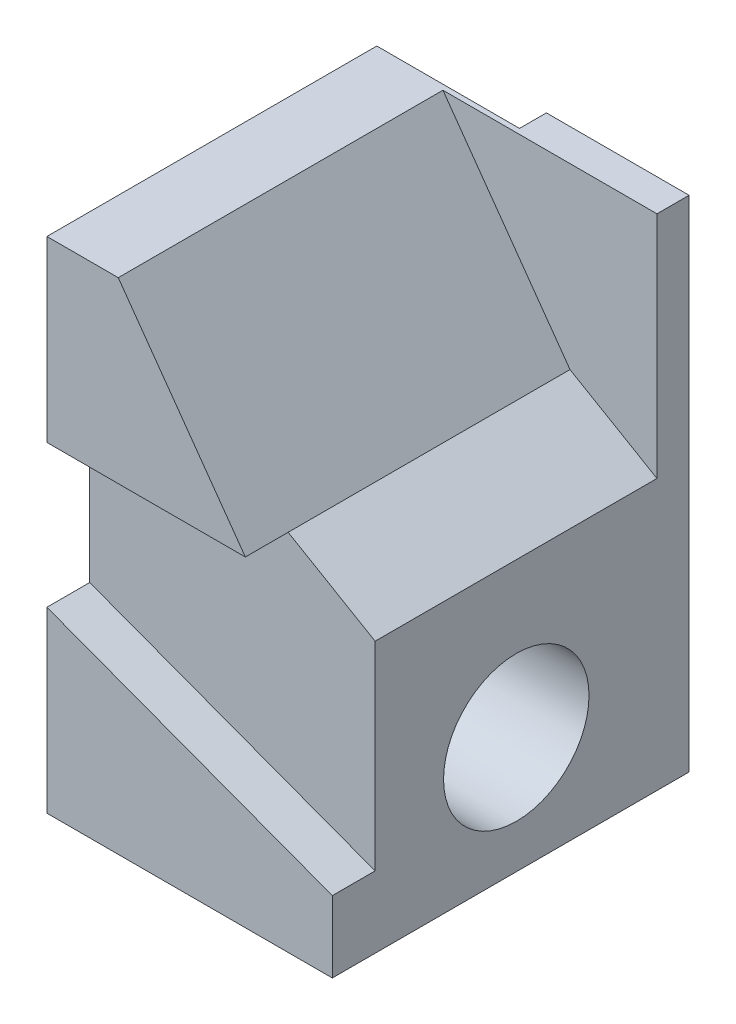
from build123d import *

# Parameters (mm, degrees)
CROQUIS1_W              = 80
CROQUIS1_H              = 88
SALIENTE_EXTRUIR2_DEPTH = 50
SALIENTE_EXTRUIR3_DEPTH = 12
SALIENTE_EXTRUIR4_DEPTH = 90
SALIENTE_EXTRUIR5_DEPTH = 12
CORTAR_EXTRUIR1_DEPTH   = 79
CORTAR_EXTRUIR3_DEPTH   = 34
CROQUIS13_R             = 20.383603437
CORTAR_EXTRUIR5_DEPTH   = 80
SALIENTE_EXTRUIR8_DEPTH = 34
CORTAR_EXTRUIR7_DEPTH   = 79


with BuildPart() as part:
    # Croquis1 → Saliente-Extruir2 (new body)
    with BuildSketch(Plane(origin=(0, 0, 0), x_dir=(1, 0, 0), z_dir=(0, 1, 0))):
        Rectangle(CROQUIS1_W, CROQUIS1_H)
    extrude(amount=SALIENTE_EXTRUIR2_DEPTH)

    # Croquis3 → Saliente-Extruir3 (add)
    with BuildSketch(Plane.XY.offset(44)):
        Polygon((40, 0), (40, 20), (-40, 50), (-40, 0), align=None)
    extrude(amount=SALIENTE_EXTRUIR3_DEPTH)

    # Croquis4 → Saliente-Extruir4 (add)
    with BuildSketch(Plane(origin=(0, 50, 0), x_dir=(1, 0, 0), z_dir=(0, 1, 0))):
        Polygon((-40, -44), (-40, 36.464593772), (-20, 36.464593772), (0, 36.464593772), (0, 44), (40, 44), (40, -44), align=None)
    extrude(amount=SALIENTE_EXTRUIR4_DEPTH)

    # Croquis6 → Saliente-Extruir5 (add)
    with BuildSketch(Plane.XY.offset(44)):
        Polygon((-40, 140), (-40, 90), (15.619160928, 90), (-20.00024501, 140), align=None)
    extrude(amount=SALIENTE_EXTRUIR5_DEPTH)

    # Croquis7 → Cortar-Extruir1 (cut)
    with BuildSketch(Plane.XY.offset(44)):
        Polygon((-20.00024501, 140), (40, 140), (40, 90), (15.619160928, 90), align=None)
    extrude(amount=-CORTAR_EXTRUIR1_DEPTH, mode=Mode.SUBTRACT)

    # Croquis8 → Cortar-Extruir3 (cut)
    with BuildSketch(Plane(origin=(40, 0, 0), x_dir=(0, 0, -1), z_dir=(1, 0, 0))):
        Polygon((35, 90), (35, 61.907696256), (-44, 60.140404664), (-44, 90), align=None)
    extrude(amount=-CORTAR_EXTRUIR3_DEPTH, mode=Mode.SUBTRACT)

    # Croquis13 → Cortar-Extruir5 (cut)
    with BuildSketch(Plane(origin=(40, 0, 0), x_dir=(0, 0, -1), z_dir=(1, 0, 0))):
        with Locations((-4.438083907, 32.611633529)):
            Circle(CROQUIS13_R)
    extrude(amount=-CORTAR_EXTRUIR5_DEPTH, mode=Mode.SUBTRACT)

    # Croquis16 → Saliente-Extruir8 (add)
    with BuildSketch(Plane(origin=(6, 0, 0), x_dir=(0, 0, -1), z_dir=(1, 0, 0))):
        Polygon((-44, 90), (35, 90), (35, 61.907696256), (-44, 60.140404664), align=None)
    extrude(amount=SALIENTE_EXTRUIR8_DEPTH)

    # Croquis17 → Cortar-Extruir7 (cut)
    with BuildSketch(Plane.XY.offset(44)):
        Polygon((15.619160928, 90), (40, 75.759565592), (40, 90), align=None)
    extrude(amount=-CORTAR_EXTRUIR7_DEPTH, mode=Mode.SUBTRACT)


solid = part.part
